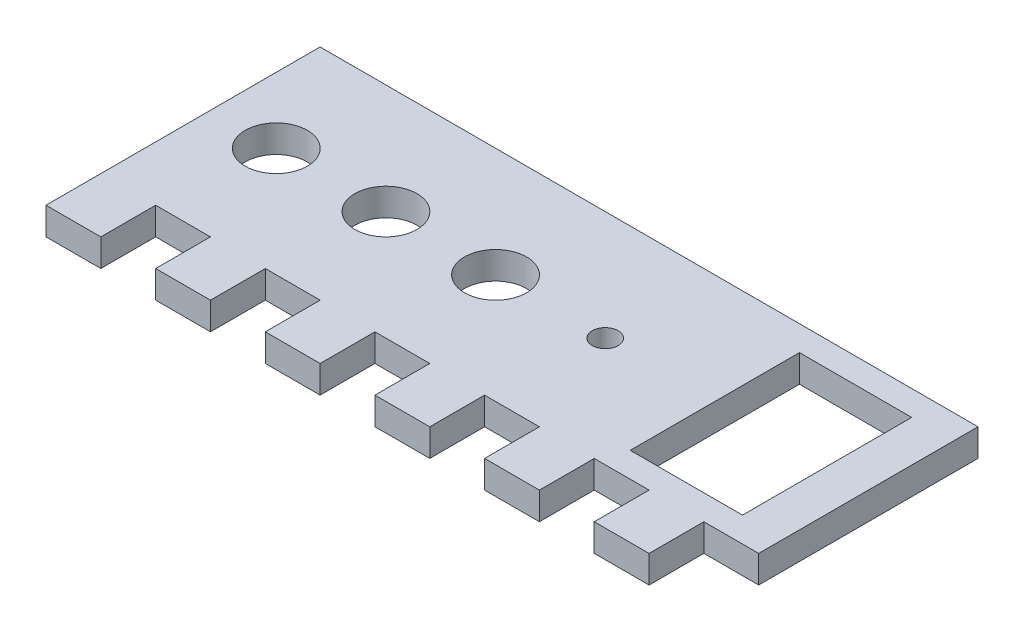
from build123d import *

# Parameters (mm, degrees)
SKETCH1_R           = 3.6
SKETCH1_R_2         = 1.5
SKETCH1_W           = 13
SKETCH1_H           = 19.6
BOSS_EXTRUDE1_DEPTH = 3.175


with BuildPart() as part:
    # Sketch1 → Boss-Extrude1 (new body)
    with BuildSketch(Plane(origin=(0, 0, 0), x_dir=(1, 0, 0), z_dir=(0, 1, 0))):
        Polygon((0, 0), (0, -6.35), (6.35, -6.35), (6.35, 0), (12.7, 0), (12.7, -6.35), (19.05, -6.35), (19.05, 0), (25.4, 0), (25.4, -6.35), (31.75, -6.35), (31.75, 0), (38.1, 0), (38.1, -6.35), (44.45, -6.35), (44.45, 0), (50.8, 0), (50.8, -6.35), (57.15, -6.35), (57.15, 0), (63.5, 0), (63.5, -6.35), (69.85, -6.35), (69.85, 0), (76.2, 0), (76.2, 25.4), (0, 25.4), align=None)
        with Locations(Location((7.62, 12.7, 0), (0, 0, 270))):
            Circle(SKETCH1_R, mode=Mode.SUBTRACT)
        with Locations(Location((20.32, 12.7, 0), (0, 0, 270))):
            Circle(SKETCH1_R, mode=Mode.SUBTRACT)
        with Locations(Location((33.02, 12.7, 0), (0, 0, 270))):
            Circle(SKETCH1_R, mode=Mode.SUBTRACT)
        with Locations(Location((45.72, 12.7, 0), (0, 0, 270))):
            Circle(SKETCH1_R_2, mode=Mode.SUBTRACT)
        with Locations((64.92, 12.7)):
            Rectangle(SKETCH1_W, SKETCH1_H, mode=Mode.SUBTRACT)
    extrude(amount=BOSS_EXTRUDE1_DEPTH)


solid = part.part
